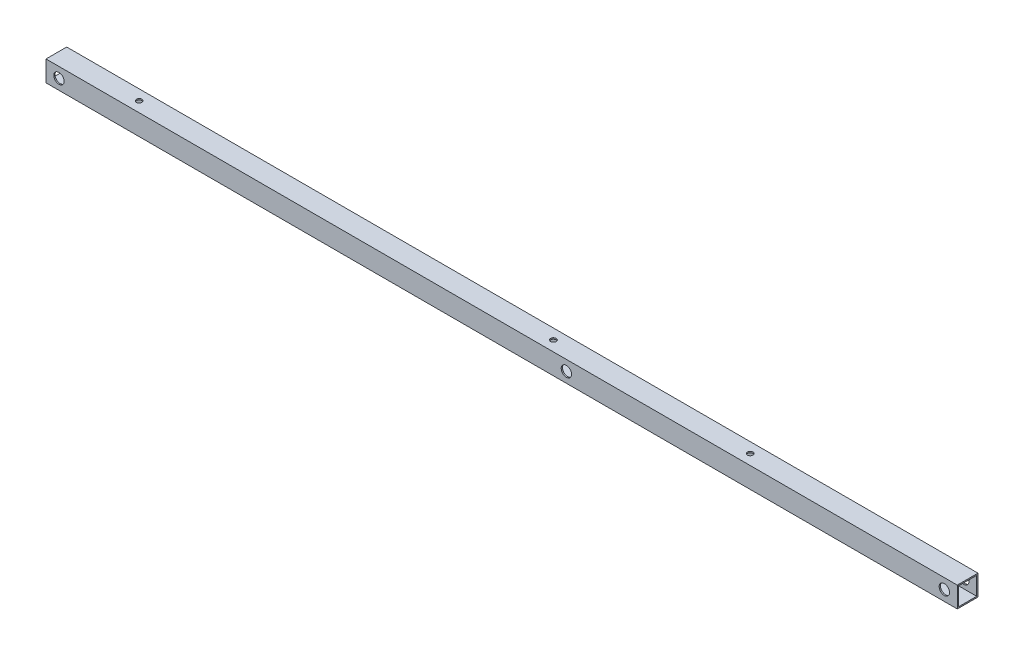
from build123d import *

# Parameters (mm, degrees)
SKETCH1_W                  = 25.4
SKETCH1_H                  = 25.4
SKETCH1_W_2                = 22.225
SKETCH1_H_2                = 22.225
EXTRUDE_THIN1_DEPTH        = 558.8
F_1_2_0_5_DIAMETER_HOLE1_D = 12.7
F_1_4_CLEARANCE_HOLE1_D    = 6.7564


with BuildPart() as part:
    # Sketch1 → Extrude-Thin1 (new, symmetric)
    with BuildSketch(Plane(origin=(0, 0, 0), x_dir=(0, 0, -1), z_dir=(1, 0, 0))):
        Rectangle(SKETCH1_W, SKETCH1_H)
        Rectangle(SKETCH1_W_2, SKETCH1_H_2, mode=Mode.SUBTRACT)
    extrude(amount=EXTRUDE_THIN1_DEPTH, both=True)

    # 1/2 (0.5) Diameter Hole1 (through all)
    with Locations(Plane.XY.offset(12.7)):
        with Locations((-542.925, 0), (542.925, 0), (79.375, 0)):
            Hole(F_1_2_0_5_DIAMETER_HOLE1_D / 2)

    # 1/4 Clearance Hole1 (through all)
    with Locations(Plane(origin=(0, 12.7, 0), x_dir=(1, 0, 0), z_dir=(0, 1, 0))):
        with Locations((-457.2, 0), (50.8, 0), (292.1, 0)):
            Hole(F_1_4_CLEARANCE_HOLE1_D / 2)


solid = part.part
